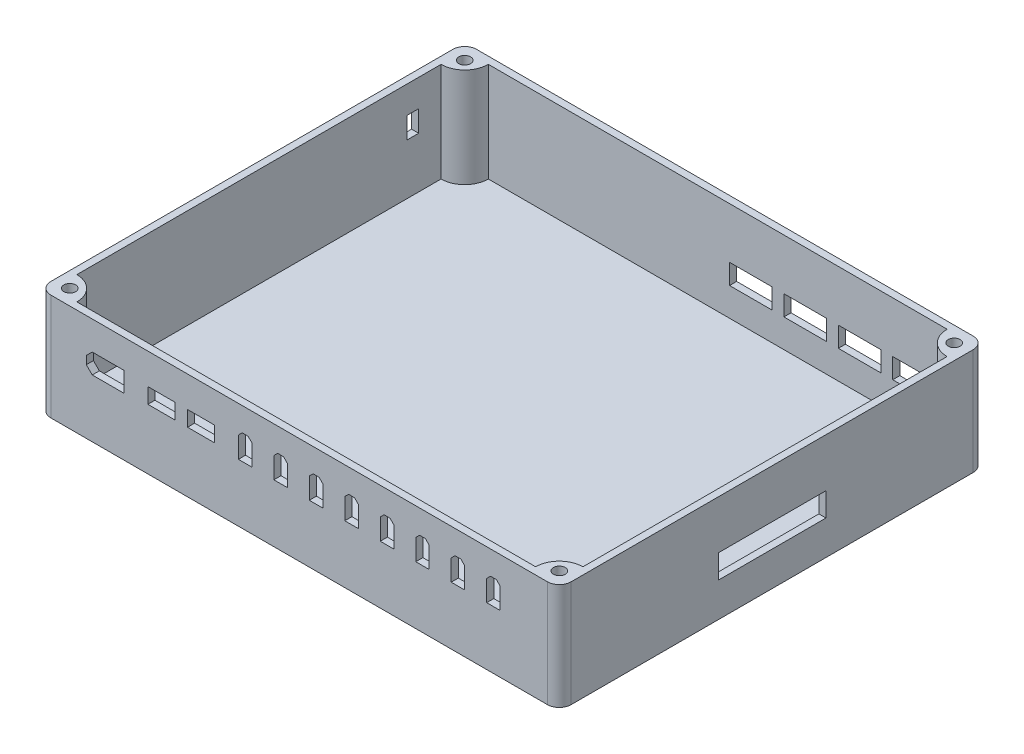
from build123d import *

# Parameters (mm, degrees)
SKETCH1_W           = 220
SKETCH1_H           = 180
BOSS_EXTRUDE1_DEPTH = 45
FILLET1_R           = 5
CUT_EXTRUDE7_DEPTH  = 42
CUT_EXTRUDE2_DEPTH  = 5
CUT_EXTRUDE3_DEPTH  = 5
SKETCH4_W           = 11.5
SKETCH4_H           = 6.5
CUT_EXTRUDE4_DEPTH  = 5
SKETCH5_W           = 45.536818034
SKETCH5_H           = 10
CUT_EXTRUDE5_DEPTH  = 5
SKETCH6_W           = 18
SKETCH6_H           = 8.5
CUT_EXTRUDE6_DEPTH  = 5
SKETCH8_W           = 5
SKETCH8_H           = 9
CUT_EXTRUDE8_DEPTH  = 4.2
SKETCH10_R          = 2.5
CUT_EXTRUDE9_DEPTH  = 40


with BuildPart() as part:
    # Sketch1 → Boss-Extrude1 (new body)
    with BuildSketch(Plane(origin=(0, 0, 0), x_dir=(1, 0, 0), z_dir=(0, 1, 0))):
        with Locations((110, 90)):
            Rectangle(SKETCH1_W, SKETCH1_H)
    extrude(amount=BOSS_EXTRUDE1_DEPTH)

    # Fillet1
    fillet1_edges = [part.edges().sort_by_distance(p)[0] for p in [
        (0, 22.5, -180),
        (220, 22.5, -180),
        (220, 22.5, 0),
        (0, 22.5, 0),
    ]]
    fillet(fillet1_edges, radius=FILLET1_R)

    # Sketch7 → Cut-Extrude7 (cut)
    with BuildSketch(Plane(origin=(0, 45, 0), x_dir=(1, 0, 0), z_dir=(0, 1, 0))):
        with BuildLine():
            Line((207, 177), (13, 177))
            ThreePointArc((13, 177), (10.071067812, 169.928932188), (3, 167))
            Line((3, 167), (3, 13))
            ThreePointArc((3, 13), (10.071067812, 10.071067812), (13, 3))
            Line((13, 3), (207, 3))
            ThreePointArc((207, 3), (209.928932188, 10.071067812), (217, 13))
            Line((217, 13), (217, 167))
            ThreePointArc((217, 167), (209.928932188, 169.928932188), (207, 177))
        make_face()
    extrude(amount=-CUT_EXTRUDE7_DEPTH, mode=Mode.SUBTRACT)

    # Sketch2 → Cut-Extrude2 (cut)
    with BuildSketch(Plane.XY):
        Polygon((175.9, 35), (178.4, 35), (180, 33.4), (180, 24.5), (174.3, 24.5), (174.3, 33.4), align=None)
        Polygon((190.9, 35), (193.4, 35), (195, 33.4), (195, 24.5), (189.3, 24.5), (189.3, 33.4), align=None)
        Polygon((160.9, 35), (163.4, 35), (165, 33.4), (165, 24.5), (159.3, 24.5), (159.3, 33.4), align=None)
        Polygon((145.9, 35), (148.4, 35), (150, 33.4), (150, 24.5), (144.3, 24.5), (144.3, 33.4), align=None)
        Polygon((130.9, 35), (133.4, 35), (135, 33.4), (135, 24.5), (129.3, 24.5), (129.3, 33.4), align=None)
        Polygon((115.9, 35), (118.4, 35), (120, 33.4), (120, 24.5), (114.3, 24.5), (114.3, 33.4), align=None)
        Polygon((100.9, 35), (103.4, 35), (105, 33.4), (105, 24.5), (99.3, 24.5), (99.3, 33.4), align=None)
        Polygon((85.9, 35), (88.4, 35), (90, 33.4), (90, 24.5), (84.3, 24.5), (84.3, 33.4), align=None)
    extrude(amount=-CUT_EXTRUDE2_DEPTH, mode=Mode.SUBTRACT)

    # Sketch3 → Cut-Extrude3 (cut)
    with BuildSketch(Plane.XY):
        Polygon((22.5, 32.9), (36, 32.9), (36, 24.5), (22.5, 24.5), (20, 27), (20, 30.4), align=None)
    extrude(amount=-CUT_EXTRUDE3_DEPTH, mode=Mode.SUBTRACT)

    # Sketch4 → Cut-Extrude4 (cut)
    with BuildSketch(Plane.XY):
        with Locations((51.75, 28.75)):
            Rectangle(SKETCH4_W, SKETCH4_H)
        with Locations((68.55, 28.75)):
            Rectangle(SKETCH4_W, SKETCH4_H)
    extrude(amount=-CUT_EXTRUDE4_DEPTH, mode=Mode.SUBTRACT)

    # Sketch5 → Cut-Extrude5 (cut)
    with BuildSketch(Plane(origin=(220, 0, 0), x_dir=(0, 0, -1), z_dir=(1, 0, 0))):
        with Locations((90, 19.480228536)):
            Rectangle(SKETCH5_W, SKETCH5_H)
    extrude(amount=-CUT_EXTRUDE5_DEPTH, mode=Mode.SUBTRACT)

    # Sketch6 → Cut-Extrude6 (cut)
    with BuildSketch(Plane(origin=(0, 0, -180), x_dir=(-1, 0, 0), z_dir=(0, 0, -1))):
        with Locations((-193, 19.25)):
            Rectangle(SKETCH6_W, SKETCH6_H)
        with Locations((-170, 19.25)):
            Rectangle(SKETCH6_W, SKETCH6_H)
        with Locations((-147, 19.25)):
            Rectangle(SKETCH6_W, SKETCH6_H)
        with Locations((-124, 19.25)):
            Rectangle(SKETCH6_W, SKETCH6_H)
    extrude(amount=-CUT_EXTRUDE6_DEPTH, mode=Mode.SUBTRACT)

    # Sketch8 → Cut-Extrude8 (cut)
    with BuildSketch(Plane.ZY):
        with Locations((-155.038386618, 29)):
            Rectangle(SKETCH8_W, SKETCH8_H)
    extrude(amount=-CUT_EXTRUDE8_DEPTH, mode=Mode.SUBTRACT)

    # Sketch10 → Cut-Extrude9 (cut)
    with BuildSketch(Plane(origin=(0, 45, 0), x_dir=(1, 0, 0), z_dir=(0, 1, 0))):
        with Locations(Location((6.5, 173.5, 0), (0, 0, 270))):
            Circle(SKETCH10_R)
        with Locations(Location((213.5, 173.5, 0), (0, 0, 90))):
            Circle(SKETCH10_R)
        with Locations(Location((213.5, 6.5, 0), (0, 0, 270))):
            Circle(SKETCH10_R)
        with Locations(Location((6.5, 6.5, 0), (0, 0, 90))):
            Circle(SKETCH10_R)
    extrude(amount=-CUT_EXTRUDE9_DEPTH, mode=Mode.SUBTRACT)


solid = part.part
